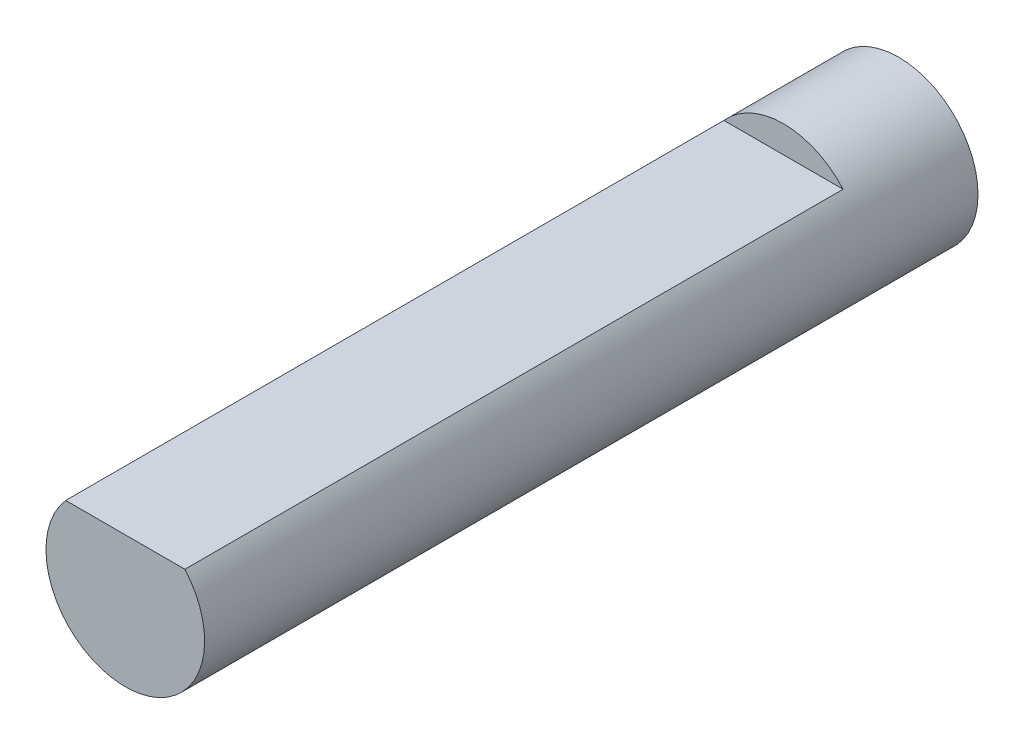
from build123d import *

# Parameters (mm, degrees)
ROD_DEPTH   = 10
SLOT_START  = -1.75
SKETCH1_3_R = 1.205
SLOT_DEPTH  = 1.75


with BuildPart() as part:
    # Sketch1 → rod (new body)
    with BuildSketch(Plane.XY):
        with BuildLine():
            Line((0.905538514, 0.795), (-0.905538514, 0.795))
            ThreePointArc((-0.905538514, 0.795), (-0.424765283, -1.127652187), (1.205, 0))
            ThreePointArc((1.205, 0), (1.127652187, 0.424765283), (0.905538514, 0.795))
        make_face()
    extrude(amount=ROD_DEPTH)

    # Sketch1<3> → Slot (add)
    with BuildSketch(Plane.XY.offset(SLOT_START)):
        Circle(SKETCH1_3_R)
    extrude(amount=SLOT_DEPTH)


solid = part.part
